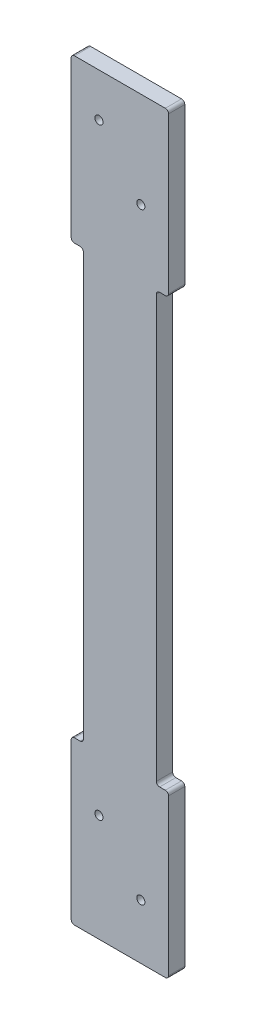
from build123d import *

# Parameters (mm, degrees)
SKETCH1_R           = 2.5
SKETCH1_W           = 45
SKETCH1_H           = 264.057811959
SKETCH1_W_2         = 60
SKETCH1_H_2         = 100
BOSS_EXTRUDE1_DEPTH = 10
FILLET1_R           = 2


with BuildPart() as part:
    # Sketch1 → Boss-Extrude1 (new body)
    # profile 1 of 3: a face of its own
    with BuildSketch(Plane.XY):
        Polygon((77.5, -321.200669102), (32.5, -321.200669102), (25, -321.200669102), (25, -421.200669102), (85, -421.200669102), (85, -321.200669102), align=None)
        with Locations((42.094920328, -355.059007065)):
            Circle(SKETCH1_R, mode=Mode.SUBTRACT)
        with Locations((67.905079672, -387.342331139)):
            Circle(SKETCH1_R, mode=Mode.SUBTRACT)
    # profile 2 of 3: a face of its own
    with BuildSketch(Plane.XY):
        with Locations((55, -189.171763123)):
            Rectangle(SKETCH1_W, SKETCH1_H)
    # profile 3 of 3: a face of its own
    with BuildSketch(Plane.XY):
        with Locations((55, -7.142857143)):
            Rectangle(SKETCH1_W_2, SKETCH1_H_2)
        with Locations((42.094920328, 16.141662037)):
            Circle(SKETCH1_R, mode=Mode.SUBTRACT)
        with Locations((67.905079672, -16.141662037)):
            Circle(SKETCH1_R, mode=Mode.SUBTRACT)
    extrude(amount=BOSS_EXTRUDE1_DEPTH)

    # Fillet1
    fillet1_edges = [part.edges().sort_by_distance(p)[0] for p in [
        (25, -421.200669102, 5),
        (25, -321.200669102, 5),
        (32.5, -321.200669102, 5),
        (32.5, -57.142857143, 5),
        (25, -57.142857143, 5),
        (25, 42.857142857, 5),
        (85, 42.857142857, 5),
        (85, -57.142857143, 5),
        (77.5, -57.142857143, 5),
        (77.5, -321.200669102, 5),
        (85, -321.200669102, 5),
        (85, -421.200669102, 5),
    ]]
    fillet(fillet1_edges, radius=FILLET1_R)


solid = part.part
